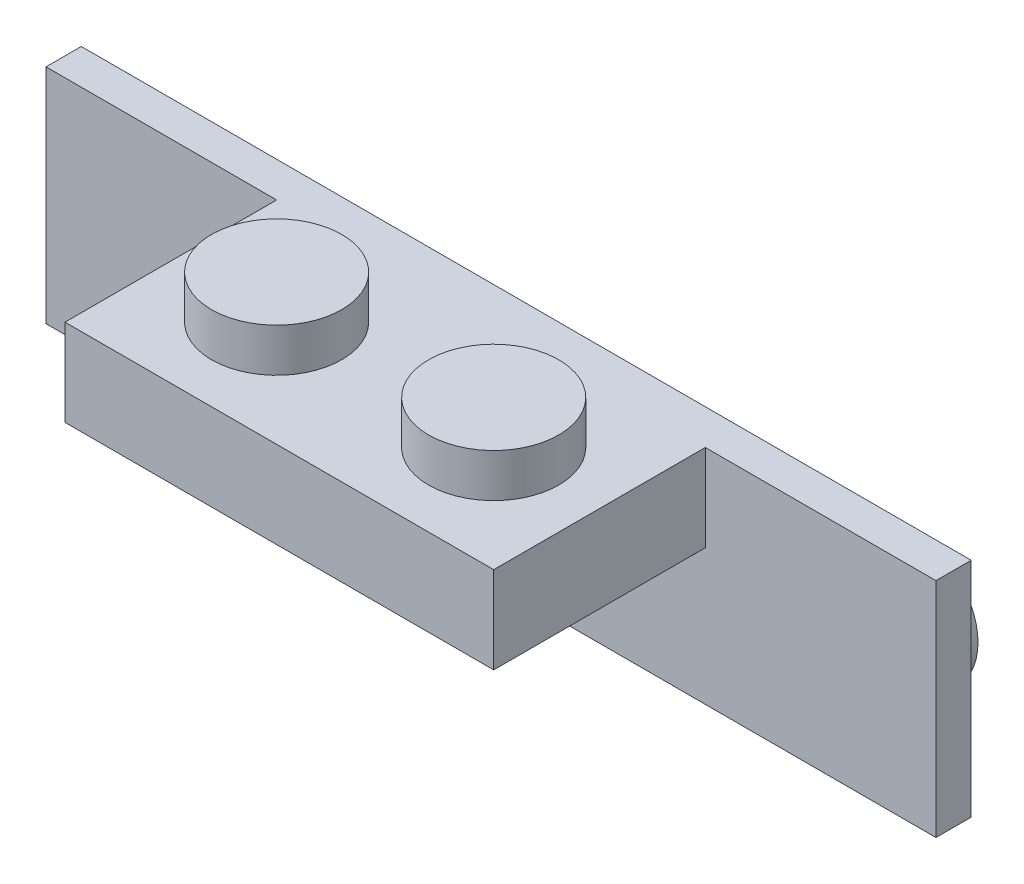
from build123d import *

# Parameters (mm, degrees)
SKETCH1_W            = 15.8
SKETCH1_H            = 3.2
BOSS_EXTRUDE1_DEPTH  = 7.8
SKETCH2_R            = 2.4
BOSS_EXTRUDE2_DEPTH  = 1.6
LPATTERN1_COUNT      = 2
LPATTERN1_PITCH      = 8
LPATTERN1_COUNT_DIR2 = 4
LPATTERN1_PITCH_DIR2 = 8
SHELL1_T             = -1.2
SKETCH3_R            = 1.5
SKETCH3_R_2          = 0.6
BOSS_EXTRUDE3_DEPTH  = 1.8
SKETCH4_W            = 32.8
SKETCH4_H            = 8.2
BOSS_EXTRUDE4_DEPTH  = 1.3
SKETCH5_R            = 2.35
SKETCH5_R_2          = 1.55
BOSS_EXTRUDE5_DEPTH  = 1.8
LPATTERN2_COUNT      = 4
LPATTERN2_PITCH      = 8


with BuildPart() as part:
    # Sketch1 → Boss-Extrude1 (new body)
    with BuildSketch(Plane.XY):
        with Locations((7.9, 1.6)):
            Rectangle(SKETCH1_W, SKETCH1_H)
    extrude(amount=-BOSS_EXTRUDE1_DEPTH)

    # Sketch2 → Boss-Extrude2 (add)
    with BuildSketch(Plane(origin=(0, 3.2, 0), x_dir=(1, 0, 0), z_dir=(0, 1, 0))):
        with Locations(Location((3.9, 3.9, 0), (0, 0, 270))):
            Circle(SKETCH2_R)
    boss_extrude2 = extrude(amount=BOSS_EXTRUDE2_DEPTH)

    # LPattern1: Boss-Extrude2 2 × 4, 6 skipped
    with Locations(*[(j * LPATTERN1_PITCH_DIR2, 0, i * LPATTERN1_PITCH) for i in range(LPATTERN1_COUNT) for j in range(LPATTERN1_COUNT_DIR2) if (i, j) not in ((0, 0), (0, 2), (0, 3), (1, 0), (1, 1), (1, 2), (1, 3))]):
        add(boss_extrude2)

    # Shell1
    shell1_openings = [part.faces().sort_by_distance(p)[0] for p in [
        (7.9, 0, -3.9),
    ]]
    offset(amount=SHELL1_T, openings=shell1_openings, kind=Kind.INTERSECTION)

    # Sketch3 → Boss-Extrude3 (add)
    with BuildSketch(Plane.XZ.offset(-2)):
        with Locations(Location((7.9, -3.9, 0), (0, 0, 90))):
            Circle(SKETCH3_R)
        with Locations(Location((7.9, -3.9, 0), (0, 0, 270))):
            Circle(SKETCH3_R_2, mode=Mode.SUBTRACT)
    extrude(amount=BOSS_EXTRUDE3_DEPTH)

    # Sketch4 → Boss-Extrude4 (add)
    with BuildSketch(Plane(origin=(0, 0, -7.8), x_dir=(-1, 0, 0), z_dir=(0, 0, -1))):
        with Locations((-7.9, -0.9)):
            Rectangle(SKETCH4_W, SKETCH4_H)
    extrude(amount=BOSS_EXTRUDE4_DEPTH)

    # Sketch5 → Boss-Extrude5 (add)
    with BuildSketch(Plane(origin=(0, 0, -9.1), x_dir=(-1, 0, 0), z_dir=(0, 0, -1))):
        with Locations(Location((-20.4, -1.1, 0), (0, 0, 180))):
            Circle(SKETCH5_R)
        with Locations((-20.4, -1.1)):
            Circle(SKETCH5_R_2, mode=Mode.SUBTRACT)
    boss_extrude5 = extrude(amount=BOSS_EXTRUDE5_DEPTH)

    # LPattern2: Boss-Extrude5 ×4
    with Locations(*[(-i * LPATTERN2_PITCH, 0, 0) for i in range(1, LPATTERN2_COUNT)]):
        add(boss_extrude5)


solid = part.part
